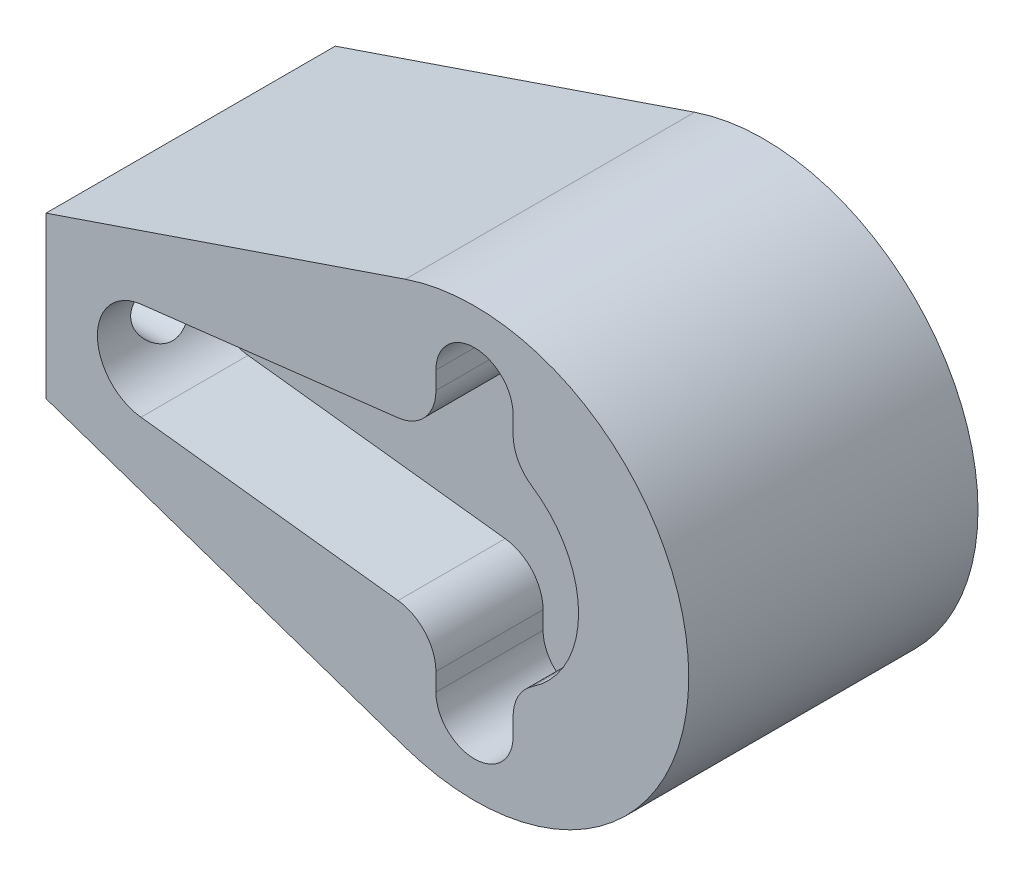
from build123d import *

# Parameters (mm, degrees)
EXTRUDE_1_DEPTH     = 5
EXTRUDE_START       = -13.5
EXTRUDE_2_DEPTH     = 8.5
SKETCH_3_R          = 2.75
EXTRUDE_3_DEPTH     = 3
SKETCH_4_R          = 1.45
CUT_EXTRUDE_1_DEPTH = 7


with BuildPart() as part:
    # Эскиз1 → Бобышка-Вытянуть1 (new body)
    with BuildSketch(Plane.XY):
        with BuildLine():
            Line((-20, 3.75), (-20, -3.75))
            Line((-20, -3.75), (-3.225194693, -9.465628304))
            ThreePointArc((-3.225194693, -9.465628304), (10, 0), (-3.225194693, 9.465628304))
            Line((-3.225194693, 9.465628304), (-20, 3.75))
        make_face()
        with BuildLine():
            Line((1.8, 5.708755266), (1.8, 6.512045083))
            ThreePointArc((1.8, 6.512045083), (3.1e-08, 8.312045083), (-1.8, 6.512045145))
            Line((-1.8, 6.512045145), (-1.8, 5.679024933))
            ThreePointArc((-1.8, 5.679024933), (-2.30564415, 4.349776802), (-3.566900594, 3.692655212))
            Line((-3.566900594, 3.692655212), (-15.568064288, 2.284325182))
            ThreePointArc((-15.568064288, 2.284325182), (-17.6, 9e-09), (-15.568064305, -2.28432518))
            Line((-15.568064305, -2.28432518), (-3.566900604, -3.692655149))
            ThreePointArc((-3.566900604, -3.692655149), (-2.305644154, -4.349776736), (-1.8, -5.679024871))
            Line((-1.8, -5.679024871), (-1.8, -6.512045083))
            ThreePointArc((-1.8, -6.512045083), (0, -8.312045083), (1.8, -6.512045083))
            Line((1.8, -6.512045083), (1.8, -5.708755266))
            ThreePointArc((1.8, -5.708755266), (2.036985071, -4.764415094), (2.691778361, -4.043869445))
            ThreePointArc((2.691778361, -4.043869445), (4.857833965, 0), (2.691778361, 4.043869445))
            ThreePointArc((2.691778361, 4.043869445), (2.036985071, 4.764415094), (1.8, 5.708755266))
        make_face(mode=Mode.SUBTRACT)
    extrude(amount=EXTRUDE_1_DEPTH)

    # Эскиз2 → Бобышка-Вытянуть2 (add)
    with BuildSketch(Plane.XY.offset(5).offset(EXTRUDE_START)):
        with BuildLine():
            Line((-3.225194693, 9.465628304), (-20, 3.75))
            Line((-20, 3.75), (-20, -3.75))
            Line((-20, -3.75), (-3.225194693, -9.465628304))
            ThreePointArc((-3.225194693, -9.465628304), (10, 0), (-3.225194693, 9.465628304))
        make_face()
    extrude(amount=EXTRUDE_2_DEPTH)

    # Эскиз3 → Бобышка-Вытянуть3 (add)
    with BuildSketch(Plane(origin=(0, 0, -8.5), x_dir=(-1, 0, 0), z_dir=(0, 0, -1))):
        with Locations(Location((0, 0, 0), (0, 0, 180))):
            Circle(SKETCH_3_R)
    extrude(amount=EXTRUDE_3_DEPTH)

    # Эскиз4 → Вырез-Вытянуть1 (cut)
    with BuildSketch(Plane.ZY.offset(20)):
        with Locations((-5.5, 0)):
            Circle(SKETCH_4_R)
        with Locations((2, 0)):
            Circle(SKETCH_4_R)
    extrude(amount=-CUT_EXTRUDE_1_DEPTH, mode=Mode.SUBTRACT)


solid = part.part
